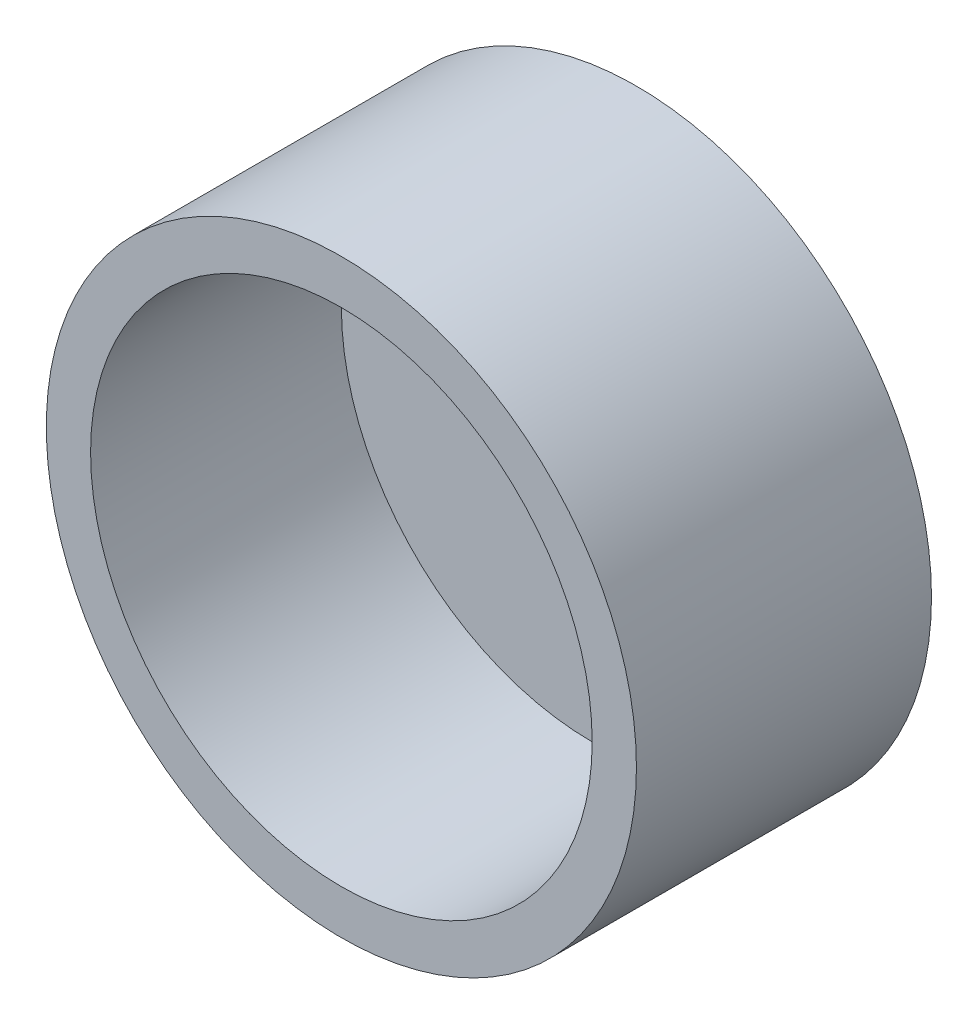
from build123d import *

# Parameters (mm, degrees)
SKETCH_3_R          = 40
EXTRUDE_2_DEPTH     = 40
SKETCH_4_R          = 34
CUT_EXTRUDE_2_DEPTH = 34


with BuildPart() as part:
    # 草图3 → 凸台-拉伸2 (new body)
    with BuildSketch(Plane.XY):
        Circle(SKETCH_3_R)
    extrude(amount=EXTRUDE_2_DEPTH)

    # 草图4 → 切除-拉伸2 (cut)
    with BuildSketch(Plane.XY.offset(40)):
        Circle(SKETCH_4_R)
    extrude(amount=-CUT_EXTRUDE_2_DEPTH, mode=Mode.SUBTRACT)


solid = part.part
